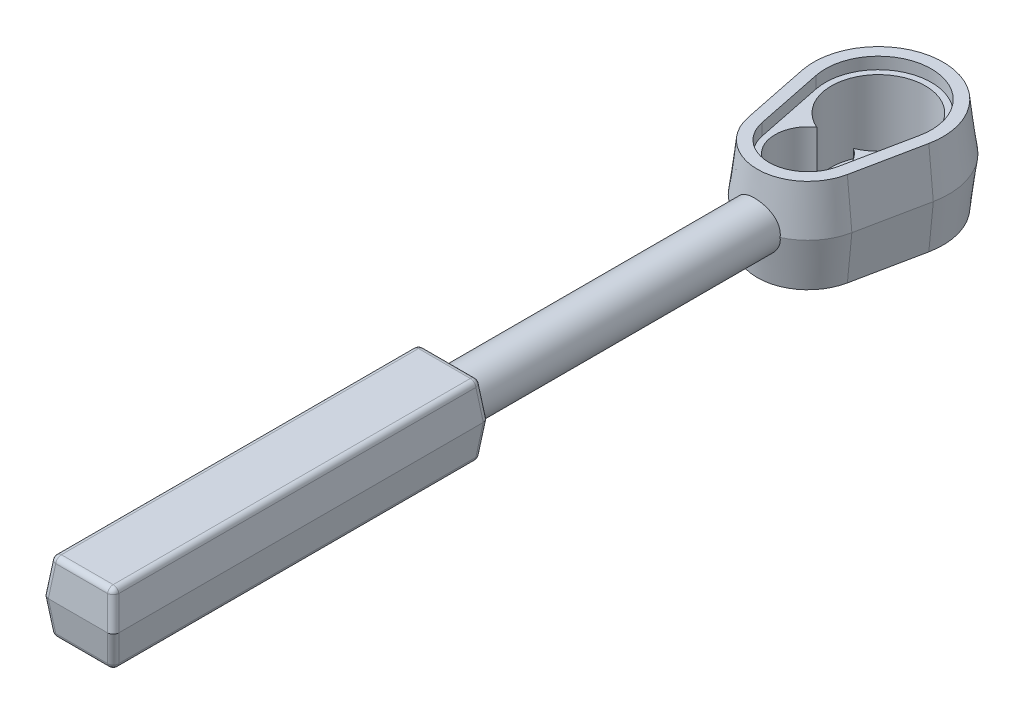
from build123d import *

# Parameters (mm, degrees)
BOSS_EXTRUDE1_DEPTH           = 12.7
BOSS_EXTRUDE1_TAPER           = 7
BOSS_EXTRUDE1_OTHER_WAY_DEPTH = 12.7
BOSS_EXTRUDE1_OTHER_WAY_TAPER = 7
CUT_EXTRUDE1_DEPTH            = 3.175
CUT_EXTRUDE2_DEPTH            = 19.05
SKETCH4_R                     = 4.7625
CUT_EXTRUDE3_DEPTH            = 46.495516237
BOSS_EXTRUDE2_REACH           = 140.336
SKETCH6_R                     = 6.35
SKETCH7_W                     = 19.05
SKETCH7_H                     = 101.6
BOSS_EXTRUDE3_DEPTH           = 9.525
BOSS_EXTRUDE3_TAPER           = 7
BOSS_EXTRUDE3_OTHER_WAY_DEPTH = 9.525
BOSS_EXTRUDE3_OTHER_WAY_TAPER = 7
FILLET1_R                     = 1.524


with BuildPart() as part:
    # Sketch1 → Boss-Extrude1 (new body)
    with BuildSketch(Plane(origin=(0, 0, 0), x_dir=(1, 0, 0), z_dir=(0, 1, 0))):
        with BuildLine():
            ThreePointArc((-14.932089472, -6.320010431), (0, -18.512010431), (14.932089472, -6.320010431))
            Line((14.932089472, -6.320010431), (18.66511184, 11.967989569))
            ThreePointArc((18.66511184, 11.967989569), (0, 34.827989569), (-18.66511184, 11.967989569))
            Line((-18.66511184, 11.967989569), (-14.932089472, -6.320010431))
        make_face()
    extrude(amount=BOSS_EXTRUDE1_DEPTH, taper=BOSS_EXTRUDE1_TAPER)

    # Sketch1 → Boss-Extrude1 other way (add)
    with BuildSketch(Plane(origin=(0, 0, 0), x_dir=(1, 0, 0), z_dir=(0, 1, 0))):
        with BuildLine():
            ThreePointArc((-14.932089472, -6.320010431), (0, -18.512010431), (14.932089472, -6.320010431))
            Line((14.932089472, -6.320010431), (18.66511184, 11.967989569))
            ThreePointArc((18.66511184, 11.967989569), (0, 34.827989569), (-18.66511184, 11.967989569))
            Line((-18.66511184, 11.967989569), (-14.932089472, -6.320010431))
        make_face()
    extrude(amount=-BOSS_EXTRUDE1_OTHER_WAY_DEPTH, taper=BOSS_EXTRUDE1_OTHER_WAY_TAPER)

    # Sketch2 → Cut-Extrude1 (cut)
    with BuildSketch(Plane(origin=(0, 12.7, 0), x_dir=(1, 0, 0), z_dir=(0, 1, 0))):
        with BuildLine():
            Line((10.293379124, -5.373137646), (14.026401492, 12.914862354))
            ThreePointArc((14.026401492, 12.914862354), (0, 30.093625645), (-14.026401492, 12.914862354))
            Line((-14.026401492, 12.914862354), (-10.293379124, -5.373137646))
            ThreePointArc((-10.293379124, -5.373137646), (0, -13.777646508), (10.293379124, -5.373137646))
        make_face()
    extrude(amount=-CUT_EXTRUDE1_DEPTH, mode=Mode.SUBTRACT)

    # Sketch3 → Cut-Extrude2 (cut)
    with BuildSketch(Plane(origin=(0, 9.525, 0), x_dir=(1, 0, 0), z_dir=(0, 1, 0))):
        with BuildLine():
            ThreePointArc((4.977363157, 4.093989569), (0, 28.477989569), (-4.977363157, 4.093989569))
            ThreePointArc((-4.977363157, 4.093989569), (0, -12.162010431), (4.977363157, 4.093989569))
        make_face()
    extrude(amount=-CUT_EXTRUDE2_DEPTH, mode=Mode.SUBTRACT)

    # Sketch4 → Cut-Extrude3 (cut, through all)
    with BuildSketch(Plane(origin=(0, -9.525, 0), x_dir=(1, 0, 0), z_dir=(0, 1, 0))):
        with Locations(Location((0, 15.777989569, 0), (0, 0, 270))):
            Circle(SKETCH4_R)
        with Locations(Location((0, -3.272010431, 0), (0, 0, 270))):
            Circle(SKETCH4_R)
    extrude(amount=-CUT_EXTRUDE3_DEPTH, mode=Mode.SUBTRACT)

    # Sketch6 → Boss-Extrude2 (add, up to next)
    with BuildSketch(Plane.XY.offset(101.6), mode=Mode.PRIVATE) as boss_extrude2_sk1:
        Circle(SKETCH6_R)
    boss_extrude2_tool1 = extrude(boss_extrude2_sk1.sketch, amount=-BOSS_EXTRUDE2_REACH, mode=Mode.PRIVATE) - part.part
    add(boss_extrude2_tool1.solids().sort_by_distance((0, 0, 101.6))[0])

    # Sketch7 → Boss-Extrude3 (add)
    with BuildSketch(Plane(origin=(0, 0, 0), x_dir=(1, 0, 0), z_dir=(0, 1, 0))):
        with Locations((0, -149.86)):
            Rectangle(SKETCH7_W, SKETCH7_H)
    extrude(amount=BOSS_EXTRUDE3_DEPTH, taper=BOSS_EXTRUDE3_TAPER)

    # Sketch7 → Boss-Extrude3 other way (add)
    with BuildSketch(Plane(origin=(0, 0, 0), x_dir=(1, 0, 0), z_dir=(0, 1, 0))):
        with Locations((0, -149.86)):
            Rectangle(SKETCH7_W, SKETCH7_H)
    extrude(amount=-BOSS_EXTRUDE3_OTHER_WAY_DEPTH, taper=BOSS_EXTRUDE3_OTHER_WAY_TAPER)

    # Fillet1
    fillet1_edges = [part.edges().sort_by_distance(p)[0] for p in [
        (8.355477057, -9.525, 149.86),
        (8.940238529, -4.7625, 99.644761471),
        (0, -9.525, 199.490477057),
        (8.940238529, -4.7625, 200.075238529),
        (-8.355477057, -9.525, 149.86),
        (-8.940238529, -4.7625, 200.075238529),
        (0, -9.525, 100.229522943),
        (-8.940238529, -4.7625, 99.644761471),
        (8.940238529, 4.7625, 200.075238529),
        (8.940238529, 4.7625, 99.644761471),
        (-8.940238529, 4.7625, 99.644761471),
        (-8.940238529, 4.7625, 200.075238529),
        (8.355477057, 9.525, 149.86),
        (0, 9.525, 100.229522943),
        (-8.355477057, 9.525, 149.86),
        (0, 9.525, 199.490477057),
    ]]
    fillet(fillet1_edges, radius=FILLET1_R)


solid = part.part
